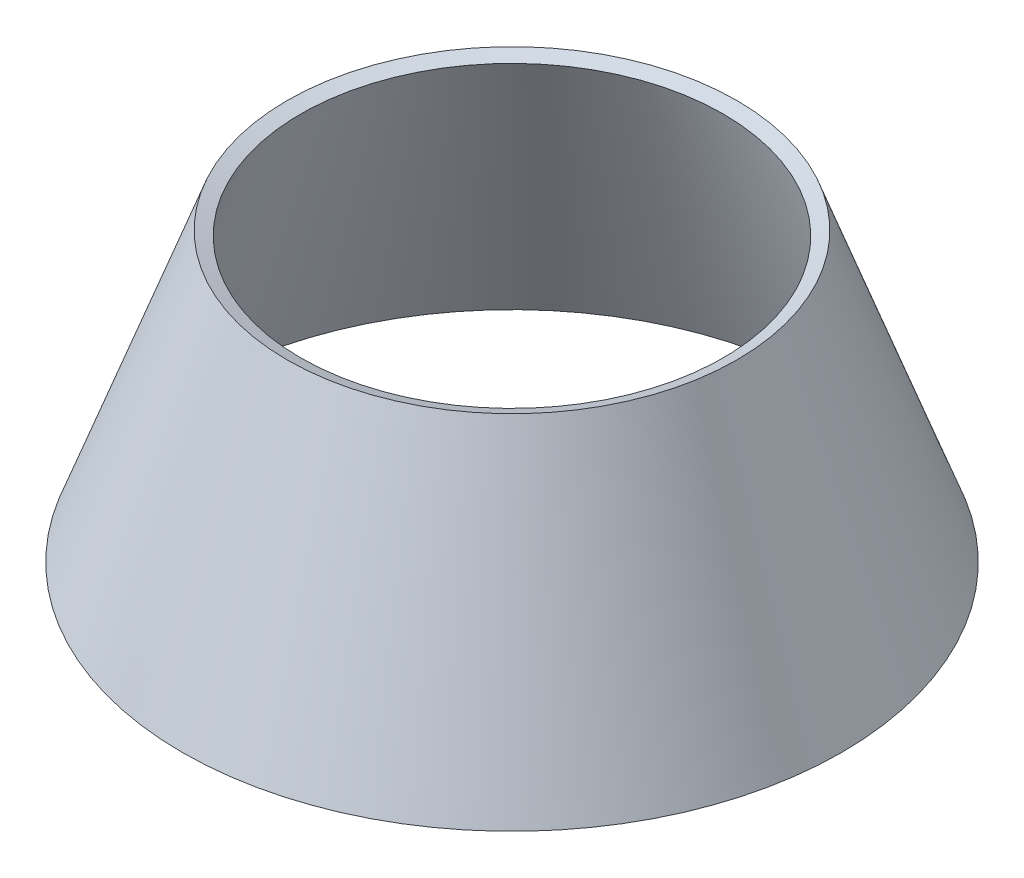
from build123d import *


with BuildPart() as part:
    # Sketch2 → Revolve-Thin1 (revolve)
    with BuildSketch(Plane.XY, mode=Mode.PRIVATE) as revolve_thin1_sk:
        Polygon((33, 0), (22.05, 30), (23.459072002, 30.514311281), (34.409072002, 0.514311281), align=None)
    revolve(revolve_thin1_sk.sketch.rotate(Axis((0, 0, 0), (0, 1, 0)), 90), axis=Axis((0, 0, 0), (0, 1, 0)))


solid = part.part
